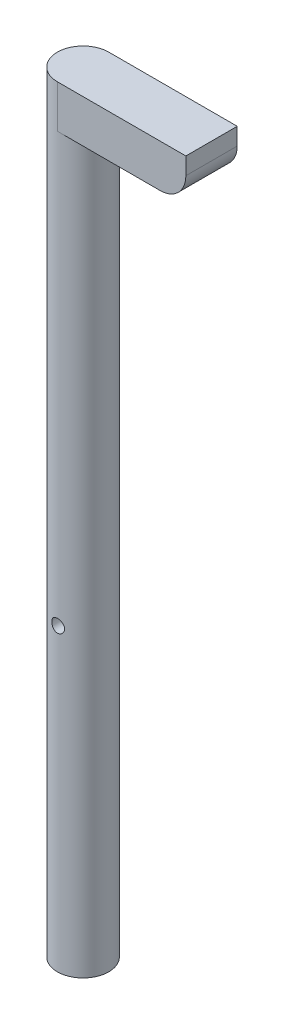
from build123d import *

# Parameters (mm, degrees)
SKETCH1_R           = 3
BOSS_EXTRUDE1_DEPTH = 90
BOSS_EXTRUDE2_DEPTH = 5
FILLET2_R           = 3
SKETCH5_R           = 0.75
CUT_EXTRUDE2_DEPTH  = 92.438503925


with BuildPart() as part:
    # Sketch1 → Boss-Extrude1 (new body)
    with BuildSketch(Plane(origin=(0, 0, 0), x_dir=(1, 0, 0), z_dir=(0, 1, 0))):
        with Locations(Location((0, 0, 0), (0, 0, 270))):
            Circle(SKETCH1_R)
    extrude(amount=-BOSS_EXTRUDE1_DEPTH)

    # Sketch2 → Boss-Extrude2 (add)
    with BuildSketch(Plane(origin=(0, 0, 0), x_dir=(1, 0, 0), z_dir=(0, 1, 0))):
        Polygon((0, 0), (0, 3), (15, 3), (15, -3), (0, -3), align=None)
    extrude(amount=-BOSS_EXTRUDE2_DEPTH)

    # Fillet2
    fillet2_edges = [part.edges().sort_by_distance(p)[0] for p in [
        (15, -5, 0),
    ]]
    fillet(fillet2_edges, radius=FILLET2_R)

    # Sketch5 → Cut-Extrude2 (cut, through all)
    with BuildSketch(Plane.XY.offset(3)):
        with Locations(Location((0, -55, 0), (0, 0, 90))):
            Circle(SKETCH5_R)
    extrude(amount=-CUT_EXTRUDE2_DEPTH, mode=Mode.SUBTRACT)


solid = part.part
